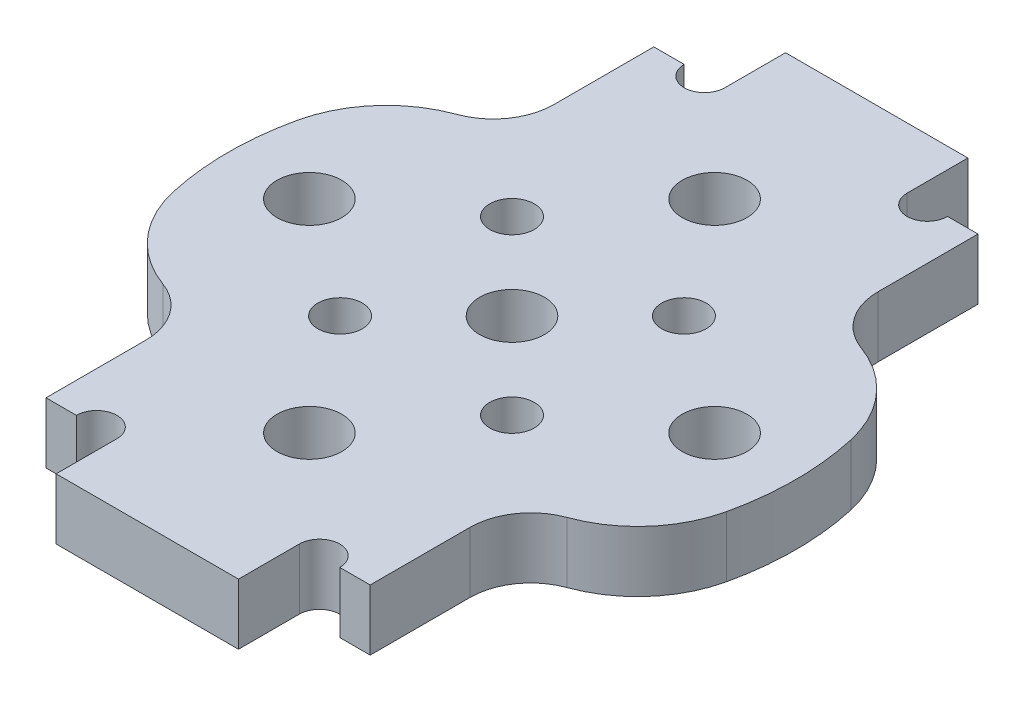
from build123d import *

# Parameters (mm, degrees)
SKETCH_1_W                = 16
SKETCH_1_H                = 30
SKETCH_1_R                = 1.6
EXTRUDE_1_DEPTH           = 3
SKETCH_2_W                = 9
SKETCH_2_H                = 3
EXTRUDE_2_DEPTH           = 3
SKETCH_3_R                = 1
CUT_EXTRUDE_1_DEPTH       = 20.924858845
SKETCH_4_R                = 1.6
EXTRUDE_3_DEPTH           = 3
SKETCH_8_R                = 1
CUT_EXTRUDE_3_DEPTH       = 24
FILLET_1_R                = 3
HOLE_WIZARD_1_D           = 2.2
HOLE_WIZARD_1_CSINK_D     = 4.5
HOLE_WIZARD_1_CSINK_ANGLE = 90


with BuildPart() as part:
    # 草图1 → 凸台-拉伸1 (new body)
    with BuildSketch(Plane(origin=(0, 0, 0), x_dir=(1, 0, 0), z_dir=(0, 1, 0))):
        Rectangle(SKETCH_1_W, SKETCH_1_H)
        with Locations(Location((0, 0, 0), (0, 0, 270))):
            Circle(SKETCH_1_R, mode=Mode.SUBTRACT)
        with Locations(Location((0, 10, 0), (0, 0, 270))):
            Circle(SKETCH_1_R, mode=Mode.SUBTRACT)
        with Locations(Location((0, -10, 0), (0, 0, 90))):
            Circle(SKETCH_1_R, mode=Mode.SUBTRACT)
    extrude(amount=EXTRUDE_1_DEPTH)

    # 草图2 → 凸台-拉伸2 (add)
    with BuildSketch(Plane(origin=(0, 3, 0), x_dir=(1, 0, 0), z_dir=(0, 1, 0))):
        with Locations((0, 16.5)):
            Rectangle(SKETCH_2_W, SKETCH_2_H)
        with Locations((0, -16.5)):
            Rectangle(SKETCH_2_W, SKETCH_2_H)
    extrude(amount=-EXTRUDE_2_DEPTH)

    # 草图3 → 切除-拉伸1 (cut, through all)
    with BuildSketch(Plane(origin=(0, 3, 0), x_dir=(1, 0, 0), z_dir=(0, 1, 0))):
        with Locations((-5.5, 15)):
            Circle(SKETCH_3_R)
        with Locations((5.5, 15)):
            Circle(SKETCH_3_R)
        with Locations((5.5, -15)):
            Circle(SKETCH_3_R)
        with Locations((-5.5, -15)):
            Circle(SKETCH_3_R)
    extrude(amount=-CUT_EXTRUDE_1_DEPTH, mode=Mode.SUBTRACT)

    # 草图4 → 凸台-拉伸3 (add)
    # profile 1 of 2: a face of its own
    with BuildSketch(Plane(origin=(0, 3, 0), x_dir=(1, 0, 0), z_dir=(0, 1, 0))):
        with BuildLine():
            Line((8, -7.6), (8, 7.6))
            ThreePointArc((8, 7.6), (11.623231276, 6.329039095), (13.658536585, 3.073170732))
            ThreePointArc((13.658536585, 3.073170732), (14, 0), (13.658536585, -3.073170732))
            ThreePointArc((13.658536585, -3.073170732), (11.623231276, -6.329039095), (8, -7.6))
        make_face()
        with Locations(Location((10, 0, 0), (0, 0, 90))):
            Circle(SKETCH_4_R, mode=Mode.SUBTRACT)
    # profile 2 of 2: a face of its own
    with BuildSketch(Plane(origin=(0, 3, 0), x_dir=(1, 0, 0), z_dir=(0, 1, 0))):
        with BuildLine():
            Line((-8, 7.6), (-8, -7.6))
            ThreePointArc((-8, -7.6), (-11.623231276, -6.329039095), (-13.658536585, -3.073170732))
            ThreePointArc((-13.658536585, -3.073170732), (-14, 0), (-13.658536585, 3.073170732))
            ThreePointArc((-13.658536585, 3.073170732), (-11.623231276, 6.329039095), (-8, 7.6))
        make_face()
        with Locations(Location((-10, 0, 0), (0, 0, 270))):
            Circle(SKETCH_4_R, mode=Mode.SUBTRACT)
    extrude(amount=-EXTRUDE_3_DEPTH)

    # 草图8 → 切除-拉伸3 (cut, through all)
    with BuildSketch(Plane(origin=(0, 3, 0), x_dir=(1, 0, 0), z_dir=(0, 1, 0))):
        with Locations(Location((-4.242640687, 4.242640687, 0), (0, 0, 270))):
            Circle(SKETCH_8_R)
        with Locations(Location((4.242640687, 4.242640687, 0), (0, 0, 270))):
            Circle(SKETCH_8_R)
        with Locations(Location((4.242640687, -4.242640687, 0), (0, 0, 270))):
            Circle(SKETCH_8_R)
        with Locations(Location((-4.242640687, -4.242640687, 0), (0, 0, 270))):
            Circle(SKETCH_8_R)
    extrude(amount=-CUT_EXTRUDE_3_DEPTH, mode=Mode.SUBTRACT)

    # 圆角1
    fillet_1_edges = [part.edges().sort_by_distance(p)[0] for p in [
        (-8, 1.5, 7.6),
        (-8, 1.5, -7.6),
        (8, 1.5, 7.6),
        (8, 1.5, -7.6),
    ]]
    fillet(fillet_1_edges, radius=FILLET_1_R)

    # 打孔尺寸(%根据十字)槽沉头木螺钉的类型1 (through all)
    with Locations(Plane.XZ):
        with Locations((-4.242640687, -4.242640687), (4.242640687, -4.242640687), (-4.242640687, 4.242640687), (4.242640687, 4.242640687)):
            CounterSinkHole(HOLE_WIZARD_1_D / 2, HOLE_WIZARD_1_CSINK_D / 2, counter_sink_angle=HOLE_WIZARD_1_CSINK_ANGLE)


solid = part.part
